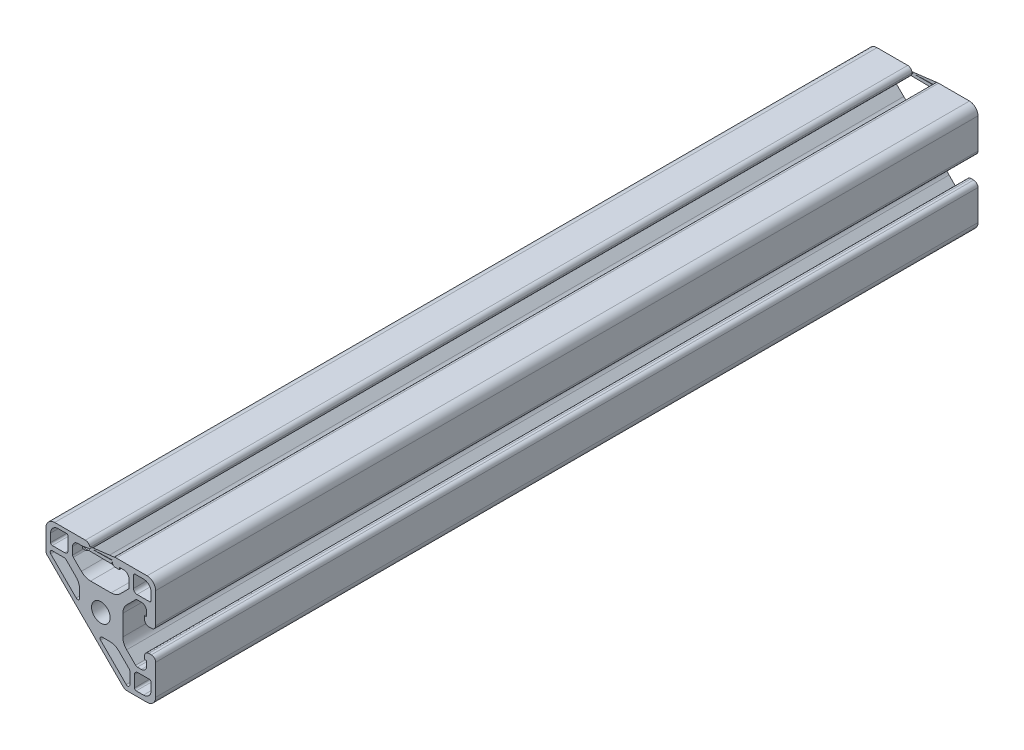
from build123d import *

# Parameters (mm, degrees)
SKETCH1_R      = 3.4
EXTRUDE1_DEPTH = 300


with BuildPart() as part:
    # Sketch1 → Extrude1 (new body)
    with BuildSketch(Plane.XY):
        with BuildLine():
            Line((14.808799083, -10.619311877), (13.321414326, -10.619311877))
            ThreePointArc((13.321414326, -10.619311877), (12.980826071, -10.551564661), (12.692089291, -10.358636913))
            Line((12.692089291, -10.358636913), (9.430586284, -7.097133906))
            ThreePointArc((9.430586284, -7.097133906), (8.4014016, -5.556850178), (8.04, -3.73996164))
            Line((8.04, -3.73996164), (8.04, 3.73996164))
            ThreePointArc((8.04, 3.73996164), (8.4014016, 5.556850178), (9.430586284, 7.097133906))
            Line((9.430586284, 7.097133906), (12.692089291, 10.358636913))
            ThreePointArc((12.692089291, 10.358636913), (12.980826071, 10.551564661), (13.321414326, 10.619311877))
            Line((13.321414326, 10.619311877), (14.808799083, 10.619311877))
            ThreePointArc((14.808799083, 10.619311877), (16.146080076, 10.065391953), (16.7, 8.72811096))
            Line((16.7, 8.72811096), (16.7, 6.913417866))
            Line((16.7, 6.913417866), (15.94, 6.913417866))
            Line((15.94, 6.913417866), (15.94, 5.759489466))
            ThreePointArc((15.94, 5.759489466), (16.399842354, 4.64933182), (17.51, 4.189489466))
            Line((17.51, 4.189489466), (18.43, 4.189489466))
            ThreePointArc((18.43, 4.189489466), (19.540157646, 4.64933182), (20, 5.759489466))
            Line((20, 5.759489466), (20, 13.038781153))
            Line((20, 13.038781153), (20, 16.86894588))
            ThreePointArc((20, 16.86894588), (19.078633802, 19.065163367), (16.888116194, 20))
            Line((16.888116194, 20), (13.060449326, 20))
            Line((13.060449326, 20), (5.629488086, 20))
            ThreePointArc((5.629488086, 20), (4.533595786, 19.554241997), (4.06, 18.470089257))
            Line((4.06, 18.470089257), (4.06, 17.550089257))
            ThreePointArc((4.06, 17.550089257), (4.741862057, 16.969863134), (5.63, 16.85668534))
            Line((5.63, 16.85668534), (6.753519305, 16.85668534))
            Line((6.753519305, 16.85668534), (6.753519305, 17.61668534))
            Line((6.753519305, 17.61668534), (8.369819728, 17.61668534))
            ThreePointArc((8.369819728, 17.61668534), (9.724056685, 17.055742026), (10.285, 15.701505068))
            Line((10.285, 15.701505068), (10.285, 12.815417808))
            ThreePointArc((10.285, 12.815417808), (10.272911804, 12.690662781), (10.237096964, 12.570549342))
            Line((10.237096964, 12.570549342), (7.097133906, 9.430586284))
            ThreePointArc((7.097133906, 9.430586284), (5.556850178, 8.4014016), (3.73996164, 8.04))
            Line((3.73996164, 8.04), (-3.73996164, 8.04))
            ThreePointArc((-3.73996164, 8.04), (-5.556850178, 8.4014016), (-7.097133906, 9.430586284))
            Line((-7.097133906, 9.430586284), (-10.028881252, 12.36233363))
            ThreePointArc((-10.028881252, 12.36233363), (-10.218436906, 12.646023714), (-10.285, 12.980658984))
            Line((-10.285, 12.980658984), (-10.285, 15.701505068))
            ThreePointArc((-10.285, 15.701505068), (-9.724056685, 17.055742026), (-8.369819728, 17.61668534))
            Line((-8.369819728, 17.61668534), (-6.753519305, 17.61668534))
            Line((-6.753519305, 17.61668534), (-6.753519305, 16.85668534))
            Line((-6.753519305, 16.85668534), (-5.63, 16.85668534))
            ThreePointArc((-5.63, 16.85668534), (-4.519842354, 17.316527694), (-4.06, 18.42668534))
            Line((-4.06, 18.42668534), (-4.06, 18.415297048))
            ThreePointArc((-4.06, 18.415297048), (-4.514587341, 19.53494714), (-5.629931152, 20))
            Line((-5.629931152, 20), (-12.97420003, 20))
            Line((-12.97420003, 20), (-16.83, 20))
            ThreePointArc((-16.83, 20), (-19.071528496, 19.071528496), (-20, 16.83))
            Line((-20, 16.83), (-20, 9.352375707))
            ThreePointArc((-20, 9.352375707), (-19.885819299, 8.778350559), (-19.560660172, 8.291715536))
            Line((-19.560660172, 8.291715536), (8.291715536, -19.560660172))
            ThreePointArc((8.291715536, -19.560660172), (8.778350559, -19.885819299), (9.352375707, -20))
            Line((9.352375707, -20), (16.83, -20))
            ThreePointArc((16.83, -20), (19.071528496, -19.071528496), (20, -16.83))
            Line((20, -16.83), (20, -12.959910743))
            Line((20, -12.959910743), (20, -5.759489466))
            ThreePointArc((20, -5.759489466), (19.540157646, -4.64933182), (18.43, -4.189489466))
            Line((18.43, -4.189489466), (17.51, -4.189489466))
            ThreePointArc((17.51, -4.189489466), (16.399842354, -4.64933182), (15.94, -5.759489466))
            Line((15.94, -5.759489466), (15.94, -6.913417866))
            Line((15.94, -6.913417866), (16.7, -6.913417866))
            Line((16.7, -6.913417866), (16.7, -8.72811096))
            ThreePointArc((16.7, -8.72811096), (16.146080076, -10.065391953), (14.808799083, -10.619311877))
        make_face()
        Circle(SKETCH1_R, mode=Mode.SUBTRACT)
        with BuildLine():
            Line((15.55, 18.332033793), (12.565, 18.332033793))
            ThreePointArc((12.565, 18.332033793), (12.119522728, 18.147511065), (11.935, 17.702033793))
            Line((11.935, 17.702033793), (11.935, 13.539311877))
            ThreePointArc((11.935, 13.539311877), (12.306974388, 12.641286265), (13.205, 12.269311877))
            Line((13.205, 12.269311877), (17.745, 12.269311877))
            ThreePointArc((17.745, 12.269311877), (18.155466507, 12.441140176), (18.35, 12.84134567))
            Line((18.35, 12.84134567), (18.35, 15.532033793))
            ThreePointArc((18.35, 15.532033793), (17.529898987, 17.51193278), (15.55, 18.332033793))
        make_face(mode=Mode.SUBTRACT)
        with BuildLine():
            Line((12.899311877, -18.35), (15.55, -18.35))
            ThreePointArc((15.55, -18.35), (17.529898987, -17.529898987), (18.35, -15.55))
            Line((18.35, -15.55), (18.35, -12.899311877))
            ThreePointArc((18.35, -12.899311877), (18.165477272, -12.453834605), (17.72, -12.269311877))
            Line((17.72, -12.269311877), (13.539311877, -12.269311877))
            ThreePointArc((13.539311877, -12.269311877), (12.641286265, -12.641286265), (12.269311877, -13.539311877))
            Line((12.269311877, -13.539311877), (12.269311877, -17.72))
            ThreePointArc((12.269311877, -17.72), (12.453834605, -18.165477272), (12.899311877, -18.35))
        make_face(mode=Mode.SUBTRACT)
        with BuildLine():
            Line((10.570252142, -17.631285379), (10.570252142, -13.218506827))
            ThreePointArc((10.570252142, -13.218506827), (10.512400587, -12.927667419), (10.347653296, -12.681105674))
            Line((10.347653296, -12.681105674), (6.607859905, -8.941312283))
            ThreePointArc((6.607859905, -8.941312283), (5.071081755, -7.914469952), (3.258328328, -7.553890876))
            Line((3.258328328, -7.553890876), (0.492857639, -7.553890876))
            ThreePointArc((0.492857639, -7.553890876), (-0.209290806, -8.023051467), (-0.044543515, -8.85129203))
            Line((-0.044543515, -8.85129203), (9.272850988, -18.168686533))
            ThreePointArc((9.272850988, -18.168686533), (10.101091551, -18.333433824), (10.570252142, -17.631285379))
        make_face(mode=Mode.SUBTRACT)
        with BuildLine():
            Line((-9.090947666, 6.757495288), (-12.702123878, 10.3686715))
            ThreePointArc((-12.702123878, 10.3686715), (-12.979745842, 10.554172566), (-13.307223277, 10.619311877))
            Line((-13.307223277, 10.619311877), (-17.720001828, 10.619311877))
            ThreePointArc((-17.720001828, 10.619311877), (-18.422150273, 10.150151286), (-18.257402982, 9.321910724))
            Line((-18.257402982, 9.321910724), (-8.997765304, 0.062273046))
            ThreePointArc((-8.997765304, 0.062273046), (-8.169524742, -0.102474245), (-7.70036415, 0.599674199))
            Line((-7.70036415, 0.599674199), (-7.70036415, 3.400329705))
            ThreePointArc((-7.70036415, 3.400329705), (-8.061765031, 5.217214626), (-9.090947666, 6.757495288))
        make_face(mode=Mode.SUBTRACT)
        with BuildLine():
            Line((-17.695, 12.269311877), (-13.205, 12.269311877))
            ThreePointArc((-13.205, 12.269311877), (-12.306974388, 12.641286265), (-11.935, 13.539311877))
            Line((-11.935, 13.539311877), (-11.935, 18.049311877))
            ThreePointArc((-11.935, 18.049311877), (-12.119522728, 18.49478915), (-12.565, 18.679311877))
            Line((-12.565, 18.679311877), (-15.525, 18.679311877))
            ThreePointArc((-15.525, 18.679311877), (-17.504898987, 17.859210865), (-18.325, 15.879311877))
            Line((-18.325, 15.879311877), (-18.325, 12.899311877))
            ThreePointArc((-18.325, 12.899311877), (-18.140477272, 12.453834605), (-17.695, 12.269311877))
        make_face(mode=Mode.SUBTRACT)
    extrude(amount=-EXTRUDE1_DEPTH)


solid = part.part
